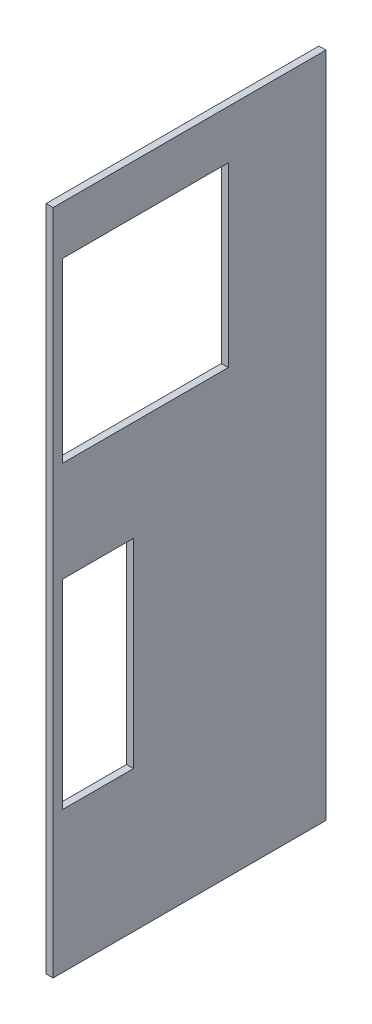
from build123d import *

# Parameters (mm, degrees)
SKETCH_1_W          = 95
SKETCH_1_H          = 38.85
EXTRUDE_1_DEPTH     = 1
SKETCH_2_W          = 10.1
SKETCH_2_H          = 28.4
SKETCH_2_W_2        = 23.6
SKETCH_2_H_2        = 25.25
CUT_EXTRUDE_1_DEPTH = 10


with BuildPart() as part:
    # Эскиз1 → Бобышка-Вытянуть1 (new body)
    with BuildSketch(Plane(origin=(0.5, 0, 0), x_dir=(0, -1, 0), z_dir=(-1, 0, 0))):
        with Locations((-53.35, 22.825)):
            Rectangle(SKETCH_1_W, SKETCH_1_H)
    extrude(amount=-EXTRUDE_1_DEPTH)

    # Эскиз2 → Вырез-Вытянуть1 (cut)
    with BuildSketch(Plane.ZY.offset(-0.5)):
        with Locations((35.85, 40.15)):
            Rectangle(SKETCH_2_W, SKETCH_2_H)
        with Locations((29.1, 81.275)):
            Rectangle(SKETCH_2_W_2, SKETCH_2_H_2)
    extrude(amount=-CUT_EXTRUDE_1_DEPTH, mode=Mode.SUBTRACT)


solid = part.part
